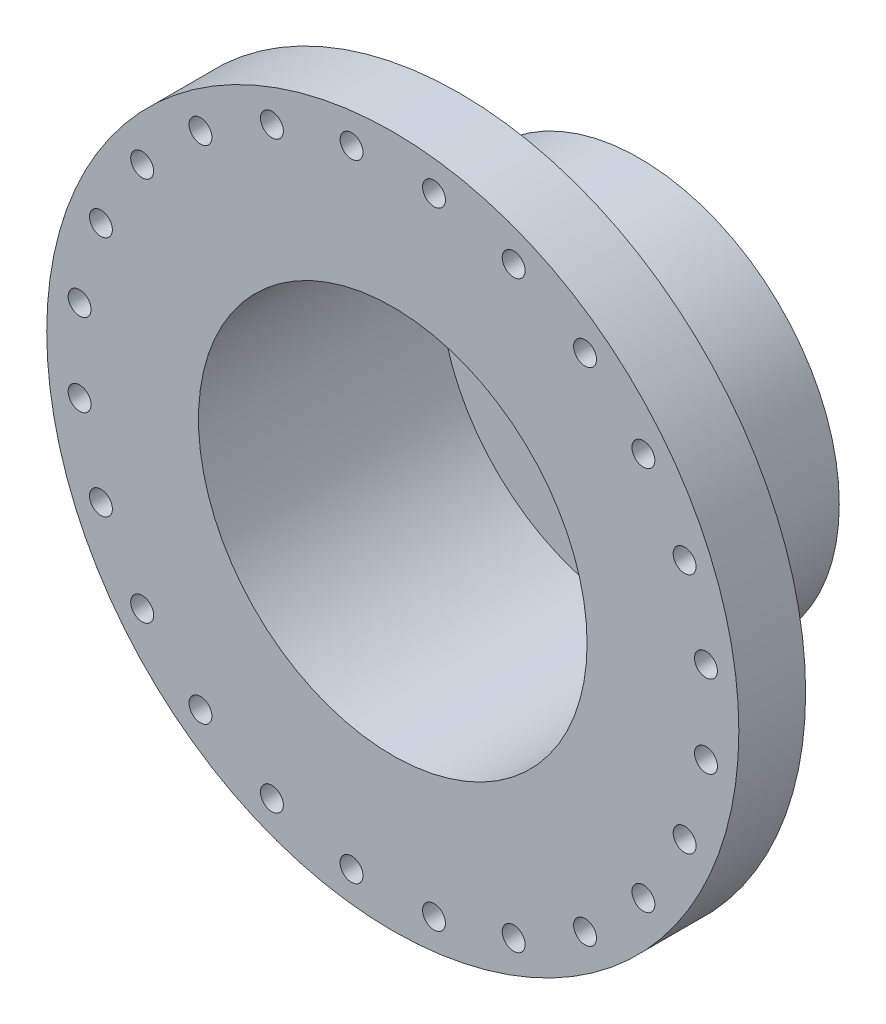
from build123d import *

# Parameters (mm, degrees)
SKETCH1_R          = 73.3072
SKETCH1_R_2        = 71.3072
EXTRUDE1_DEPTH     = 66.04
EXTRUDE2_START     = 24.511
SKETCH2_R          = 127
SKETCH2_R_2        = 71.3072
EXTRUDE2_DEPTH     = 24.511
CUT_EXTRUDE1_REACH = 203.14
SKETCH3_R          = 4.2
CIRPATTERN1_COUNT  = 24
EXTRUDE3_START     = -2
SKETCH4_R          = 73.3072
SKETCH4_R_2        = 25.4
EXTRUDE3_DEPTH     = 2
EXTRUDE5_START     = -5
SKETCH8_R          = 29.21
SKETCH8_R_2        = 25.4
EXTRUDE5_DEPTH     = 5


with BuildPart() as part:
    # Sketch1 → Extrude1 (new body)
    with BuildSketch(Plane.XY):
        Circle(SKETCH1_R)
        Circle(SKETCH1_R_2, mode=Mode.SUBTRACT)
    extrude(amount=-EXTRUDE1_DEPTH)

    # Sketch2 → Extrude2 (add)
    with BuildSketch(Plane.XY.offset(EXTRUDE2_START)):
        Circle(SKETCH2_R)
        Circle(SKETCH2_R_2, mode=Mode.SUBTRACT)
    extrude(amount=-EXTRUDE2_DEPTH)

    # Sketch3 → Cut-Extrude1 (cut, up to next)
    with BuildSketch(Plane.XY.offset(24.511), mode=Mode.PRIVATE) as cut_extrude1_sk1:
        with Locations((15.131327149, -114.933840422)):
            Circle(SKETCH3_R)
    cut_extrude1_tool1 = extrude(cut_extrude1_sk1.sketch, amount=-CUT_EXTRUDE1_REACH, mode=Mode.PRIVATE) & part.part
    cut_extrude1 = cut_extrude1_tool1.solids().sort_by_distance((15.131327, -114.93384, 24.511))[0]
    add(cut_extrude1, mode=Mode.SUBTRACT)

    # CirPattern1: Cut-Extrude1 ×24 about axis
    cirpattern1_axis = Axis((0, 0, 0), (0, 0, 1))
    for i in range(1, CIRPATTERN1_COUNT):
        add(cut_extrude1.rotate(cirpattern1_axis, i * 360 / CIRPATTERN1_COUNT), mode=Mode.SUBTRACT)

    # Sketch4 → Extrude3 (add)
    with BuildSketch(Plane(origin=(0, 0, -66.04), x_dir=(-1, 0, 0), z_dir=(0, 0, -1)).offset(EXTRUDE3_START)):
        with Locations(Location((0, 0, 0), (0, 0, 180))):
            Circle(SKETCH4_R)
        Circle(SKETCH4_R_2, mode=Mode.SUBTRACT)
    extrude(amount=EXTRUDE3_DEPTH)

    # Sketch8 → Extrude5 (add)
    with BuildSketch(Plane(origin=(0, 0, -66.04), x_dir=(-1, 0, 0), z_dir=(0, 0, -1)).offset(EXTRUDE5_START)):
        Circle(SKETCH8_R)
        Circle(SKETCH8_R_2, mode=Mode.SUBTRACT)
    extrude(amount=EXTRUDE5_DEPTH)

    # Sketch9 → Cut-Revolve1 (revolve, cut)
    with BuildSketch(Plane(origin=(0, 0, 0), x_dir=(1, 0, 0), z_dir=(0, 1, 0)), mode=Mode.PRIVATE) as cut_revolve1_sk:
        Polygon((-29.145718757, 61.04), (-25.4, 66.04), (-25.4, 61.04), align=None)
    revolve(cut_revolve1_sk.sketch.rotate(Axis((0, 0, 0), (0, 0, -1)), 180), axis=Axis((0, 0, 0), (0, 0, -1)), mode=Mode.SUBTRACT)


solid = part.part
